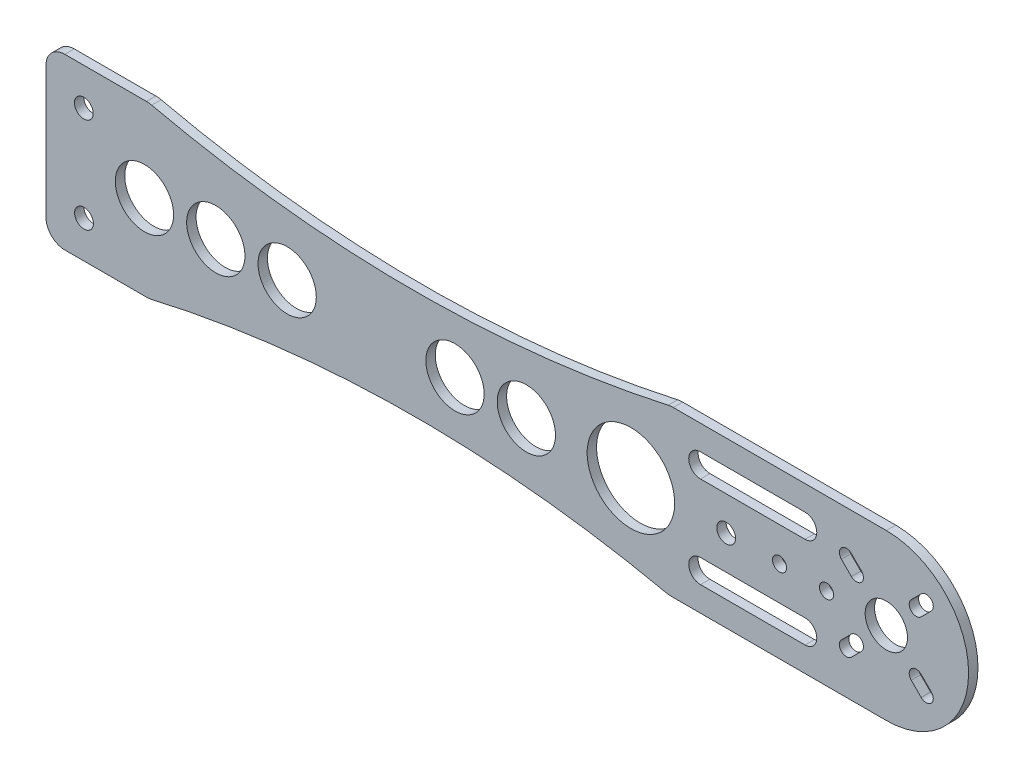
from build123d import *

# Parameters (mm, degrees)
CROQUIS1_R              = 2
CROQUIS1_R_2            = 4.5
CROQUIS1_R_3            = 6.198274882
CROQUIS1_R_4            = 1.5
CROQUIS1_R_5            = 9.306378824
SALIENTE_EXTRUIR1_DEPTH = 2


with BuildPart() as part:
    # Croquis1 → Saliente-Extruir1 (new body)
    with BuildSketch(Plane.XY):
        with BuildLine():
            Line((2814.976573627, 1239.042814145), (2832.341923679, 1239.042814145))
            ThreePointArc((2832.341923679, 1239.042814145), (2832.901941116, 1239.011353213), (2833.454911085, 1238.917366333))
            ThreePointArc((2833.454911085, 1238.917366333), (2888.36527428, 1232.640523344), (2943.314155481, 1238.570717173))
            ThreePointArc((2943.314155481, 1238.570717173), (2943.852021738, 1238.659519694), (2944.396358769, 1238.689238294))
            Line((2944.396358769, 1238.689238294), (2989.714258788, 1238.689238294))
            ThreePointArc((2989.714258788, 1238.689238294), (3007.214258788, 1221.189238294), (2989.714258788, 1203.689238294))
            Line((2989.714258788, 1203.689238294), (2943.987436651, 1203.689238294))
            ThreePointArc((2943.987436651, 1203.689238294), (2943.452657793, 1203.717919397), (2942.924014155, 1203.803633664))
            ThreePointArc((2942.924014155, 1203.803633664), (2888.146718467, 1209.523748699), (2833.444892603, 1203.122023463))
            ThreePointArc((2833.444892603, 1203.122023463), (2832.886438978, 1203.026115147), (2832.320719962, 1202.994008262))
            Line((2832.320719962, 1202.994008262), (2814.976573627, 1202.994008262))
            ThreePointArc((2814.976573627, 1202.994008262), (2812.148146502, 1204.165581137), (2810.976573627, 1206.994008262))
            Line((2810.976573627, 1206.994008262), (2810.976573627, 1235.042814145))
            ThreePointArc((2810.976573627, 1235.042814145), (2812.148146502, 1237.871241269), (2814.976573627, 1239.042814145))
        make_face()
        with Locations((2819.024210059, 1231.146271353)):
            Circle(CROQUIS1_R, mode=Mode.SUBTRACT)
        with Locations((2989.714258788, 1221.189238294)):
            Circle(CROQUIS1_R_2, mode=Mode.SUBTRACT)
        with Locations((2819.05924577, 1210.890776447)):
            Circle(CROQUIS1_R, mode=Mode.SUBTRACT)
        with Locations((2831.917693785, 1221.023549437)):
            Circle(CROQUIS1_R_3, mode=Mode.SUBTRACT)
        with Locations((2847.093240202, 1221.039483998)):
            Circle(CROQUIS1_R_3, mode=Mode.SUBTRACT)
        with Locations((2862.26878662, 1221.055418559)):
            Circle(CROQUIS1_R_3, mode=Mode.SUBTRACT)
        with Locations((2966.996257677, 1221.189238294)):
            Circle(CROQUIS1_R_4, mode=Mode.SUBTRACT)
        with Locations((2976.996257677, 1221.189238294)):
            Circle(CROQUIS1_R_4, mode=Mode.SUBTRACT)
        with Locations((2955.642950592, 1221.189238294)):
            Circle(CROQUIS1_R, mode=Mode.SUBTRACT)
        with Locations((2935.388208278, 1221.189238294)):
            Circle(CROQUIS1_R_5, mode=Mode.SUBTRACT)
        with Locations((2897.973392618, 1221.039483998)):
            Circle(CROQUIS1_R_3, mode=Mode.SUBTRACT)
        with Locations((2913.148939036, 1221.055418559)):
            Circle(CROQUIS1_R_3, mode=Mode.SUBTRACT)
        with BuildLine():
            Line((2982.289637586, 1215.885937435), (2980.168317242, 1213.764617091))
            ThreePointArc((2980.168317242, 1213.764617091), (2980.168317242, 1211.643296748), (2982.289637586, 1211.643296748))
            Line((2982.289637586, 1211.643296748), (2984.410957929, 1213.764617091))
            ThreePointArc((2984.410957929, 1213.764617091), (2984.410957929, 1215.885937435), (2982.289637586, 1215.885937435))
        make_face(mode=Mode.SUBTRACT)
        with BuildLine():
            Line((2995.017559647, 1213.764617091), (2997.138879991, 1211.643296748))
            ThreePointArc((2997.138879991, 1211.643296748), (2999.260200334, 1211.643296748), (2999.260200334, 1213.764617091))
            Line((2999.260200334, 1213.764617091), (2997.138879991, 1215.885937435))
            ThreePointArc((2997.138879991, 1215.885937435), (2995.017559647, 1215.885937435), (2995.017559647, 1213.764617091))
        make_face(mode=Mode.SUBTRACT)
        with BuildLine():
            Line((2997.138879991, 1226.492539153), (2999.260200334, 1228.613859496))
            ThreePointArc((2999.260200334, 1228.613859496), (2999.260200334, 1230.73517984), (2997.138879991, 1230.73517984))
            Line((2997.138879991, 1230.73517984), (2995.017559647, 1228.613859496))
            ThreePointArc((2995.017559647, 1228.613859496), (2995.017559647, 1226.492539153), (2997.138879991, 1226.492539153))
        make_face(mode=Mode.SUBTRACT)
        with BuildLine():
            Line((2984.410957929, 1228.613859496), (2982.289637586, 1230.73517984))
            ThreePointArc((2982.289637586, 1230.73517984), (2980.168317242, 1230.73517984), (2980.168317242, 1228.613859496))
            Line((2980.168317242, 1228.613859496), (2982.289637586, 1226.492539153))
            ThreePointArc((2982.289637586, 1226.492539153), (2984.410957929, 1226.492539153), (2984.410957929, 1228.613859496))
        make_face(mode=Mode.SUBTRACT)
        with BuildLine():
            Line((2950.185413449, 1233.422506858), (2972.422006236, 1233.422506858))
            ThreePointArc((2972.422006236, 1233.422506858), (2974.922006236, 1230.922506858), (2972.422006236, 1228.422506858))
            Line((2972.422006236, 1228.422506858), (2950.185413449, 1228.422506858))
            ThreePointArc((2950.185413449, 1228.422506858), (2947.685413449, 1230.922506858), (2950.185413449, 1233.422506858))
        make_face(mode=Mode.SUBTRACT)
        with BuildLine():
            Line((2950.185413449, 1208.955969729), (2972.422006236, 1208.955969729))
            ThreePointArc((2972.422006236, 1208.955969729), (2974.922006236, 1211.455969729), (2972.422006236, 1213.955969729))
            Line((2972.422006236, 1213.955969729), (2950.185413449, 1213.955969729))
            ThreePointArc((2950.185413449, 1213.955969729), (2947.685413449, 1211.455969729), (2950.185413449, 1208.955969729))
        make_face(mode=Mode.SUBTRACT)
    extrude(amount=SALIENTE_EXTRUIR1_DEPTH)


solid = part.part
